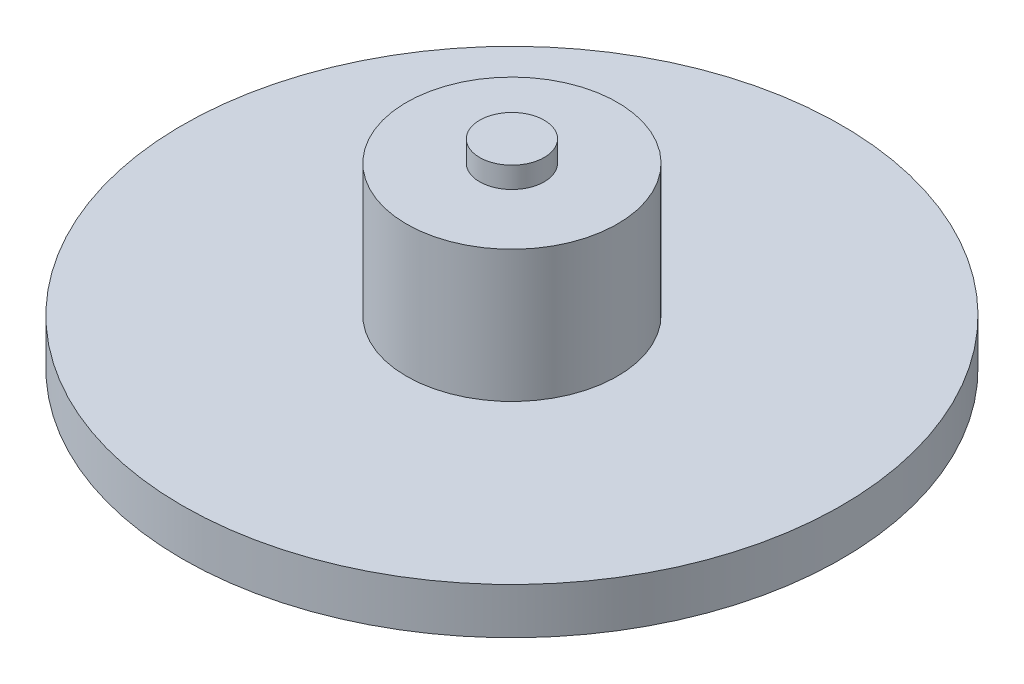
from build123d import *

# Parameters (mm, degrees)
SKETCH1_R           = 25
BOSS_EXTRUDE1_DEPTH = 3.5
SKETCH2_R           = 8
BOSS_EXTRUDE2_DEPTH = 10
SKETCH5_R           = 2.45
BOSS_EXTRUDE3_DEPTH = 1.6


with BuildPart() as part:
    # Sketch1 → Boss-Extrude1 (new body)
    with BuildSketch(Plane(origin=(0, 0, 0), x_dir=(1, 0, 0), z_dir=(0, 1, 0))):
        with Locations(Location((0, 0, 0), (0, 0, 270))):
            Circle(SKETCH1_R)
    extrude(amount=BOSS_EXTRUDE1_DEPTH)

    # Sketch2 → Boss-Extrude2 (add)
    with BuildSketch(Plane(origin=(0, 3.5, 0), x_dir=(1, 0, 0), z_dir=(0, 1, 0))):
        with Locations(Location((0, 0, 0), (0, 0, 270))):
            Circle(SKETCH2_R)
    extrude(amount=BOSS_EXTRUDE2_DEPTH)

    # Sketch5 → Boss-Extrude3 (add)
    with BuildSketch(Plane(origin=(0, 13.5, 0), x_dir=(1, 0, 0), z_dir=(0, 1, 0))):
        with Locations(Location((0, 0, 0), (0, 0, 270))):
            Circle(SKETCH5_R)
    extrude(amount=BOSS_EXTRUDE3_DEPTH)


solid = part.part
